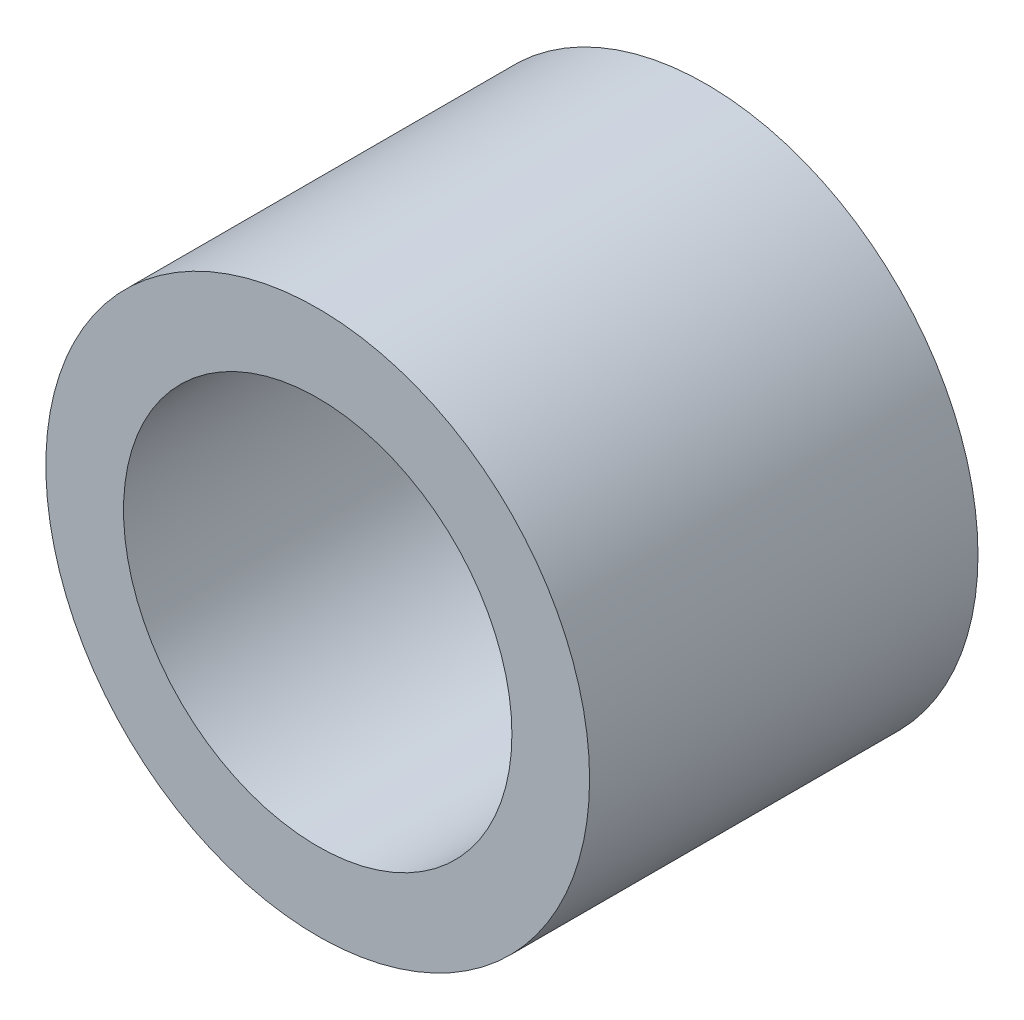
from build123d import *

# Parameters (mm, degrees)
SKETCH1_R           = 4.445
SKETCH1_R_2         = 3.175
BOSS_EXTRUDE1_DEPTH = 6.35


with BuildPart() as part:
    # Sketch1 → Boss-Extrude1 (new body)
    with BuildSketch(Plane.XY):
        Circle(SKETCH1_R)
        Circle(SKETCH1_R_2, mode=Mode.SUBTRACT)
    extrude(amount=BOSS_EXTRUDE1_DEPTH)


solid = part.part
